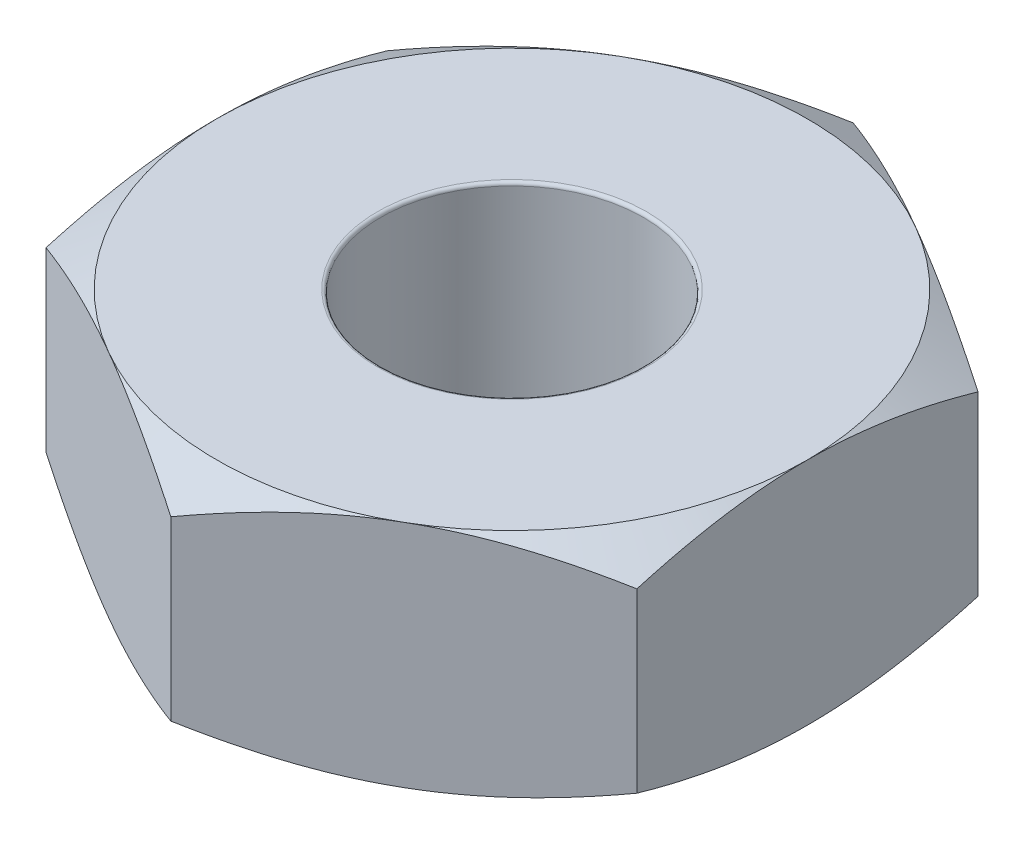
from build123d import *

# Parameters (mm, degrees)
SKETCH1_R               = 1
BOSS_EXTRUDE1_DEPTH     = 1.75
SKETCH2_OUTSIDE_W       = 13.98
SKETCH2_OUTSIDE_H       = 14.676
SKETCH2_OUTSIDE_R       = 2.25
CUT_EXTRUDE1_DEPTH      = 1.75
CUT_EXTRUDE1_DRAFT      = -60
MIRROR1_COPY_1_SKETCH_W = 13.98
MIRROR1_COPY_1_SKETCH_H = 14.676
MIRROR1_COPY_1_SKETCH_R = 2.25
MIRROR1_COPY_1_DEPTH    = 1.75
MIRROR1_COPY_1_DRAFT    = -60
FILLET1_R               = 0.025


with BuildPart() as part:
    # Sketch1 → Boss-Extrude1 (new body)
    with BuildSketch(Plane(origin=(0, 0, 0), x_dir=(1, 0, 0), z_dir=(0, 1, 0))):
        Polygon((0, 2.598076211), (-2.25, 1.299038106), (-2.25, -1.299038106), (0, -2.598076211), (2.25, -1.299038106), (2.25, 1.299038106), align=None)
        with Locations(Location((0, 0, 0), (0, 0, 270))):
            Circle(SKETCH1_R, mode=Mode.SUBTRACT)
    extrude(amount=BOSS_EXTRUDE1_DEPTH)


with BuildPart() as cut_extrude1_tool:
    # Sketch2 outside → Cut-Extrude1 (with draft: the straight prism first)
    with BuildSketch(Plane(origin=(0, 1.75, 0), x_dir=(1, 0, 0), z_dir=(0, 1, 0))):
        Rectangle(SKETCH2_OUTSIDE_W, SKETCH2_OUTSIDE_H)
        Circle(SKETCH2_OUTSIDE_R, mode=Mode.SUBTRACT)
    extrude(amount=-CUT_EXTRUDE1_DEPTH)
    # Cut-Extrude1: the draft: its side faces are tilted about the plane it starts from
    cut_extrude1_sides = [cut_extrude1_tool.faces().sort_by_distance(p)[0] for p in [
        (0, 0.875, 7.338),
        (6.99, 0.875, 0),
        (0, 0.875, -7.338),
        (-6.99, 0.875, 0),
        (-2.25, 0.875, 0),
    ]]
    draft(cut_extrude1_sides, Plane(origin=(0, 1.75, 0), x_dir=(1, 0, 0), z_dir=(0, 1, 0)), CUT_EXTRUDE1_DRAFT)


with BuildPart() as part_1:
    add(part.part)

    # Cut-Extrude1: cut by cut_extrude1_tool
    add(cut_extrude1_tool.part, mode=Mode.SUBTRACT)


with BuildPart() as mirror1_copy_1_tool:
    # Mirror1 copy 1 sketch → Mirror1 copy 1 (with draft: the straight prism first)
    with BuildSketch(Plane.XZ):
        Rectangle(MIRROR1_COPY_1_SKETCH_W, MIRROR1_COPY_1_SKETCH_H)
        Circle(MIRROR1_COPY_1_SKETCH_R, mode=Mode.SUBTRACT)
    extrude(amount=-MIRROR1_COPY_1_DEPTH)
    # Mirror1 copy 1: the draft: its side faces are tilted about the plane it starts from
    mirror1_copy_1_sides = [mirror1_copy_1_tool.faces().sort_by_distance(p)[0] for p in [
        (0, 0.875, 7.338),
        (6.99, 0.875, 0),
        (0, 0.875, -7.338),
        (-6.99, 0.875, 0),
        (-2.25, 0.875, 0),
    ]]
    draft(mirror1_copy_1_sides, Plane.XZ, MIRROR1_COPY_1_DRAFT)


with BuildPart() as part_2:
    add(part_1.part)

    # Mirror1 copy 1: cut by mirror1_copy_1_tool
    add(mirror1_copy_1_tool.part, mode=Mode.SUBTRACT)

    # Fillet1
    fillet1_edges = [part_2.edges().sort_by_distance(p)[0] for p in [
        (0, 0, -1),
        (0, 1.75, -1),
    ]]
    fillet(fillet1_edges, radius=FILLET1_R)


solid = part_2.part
